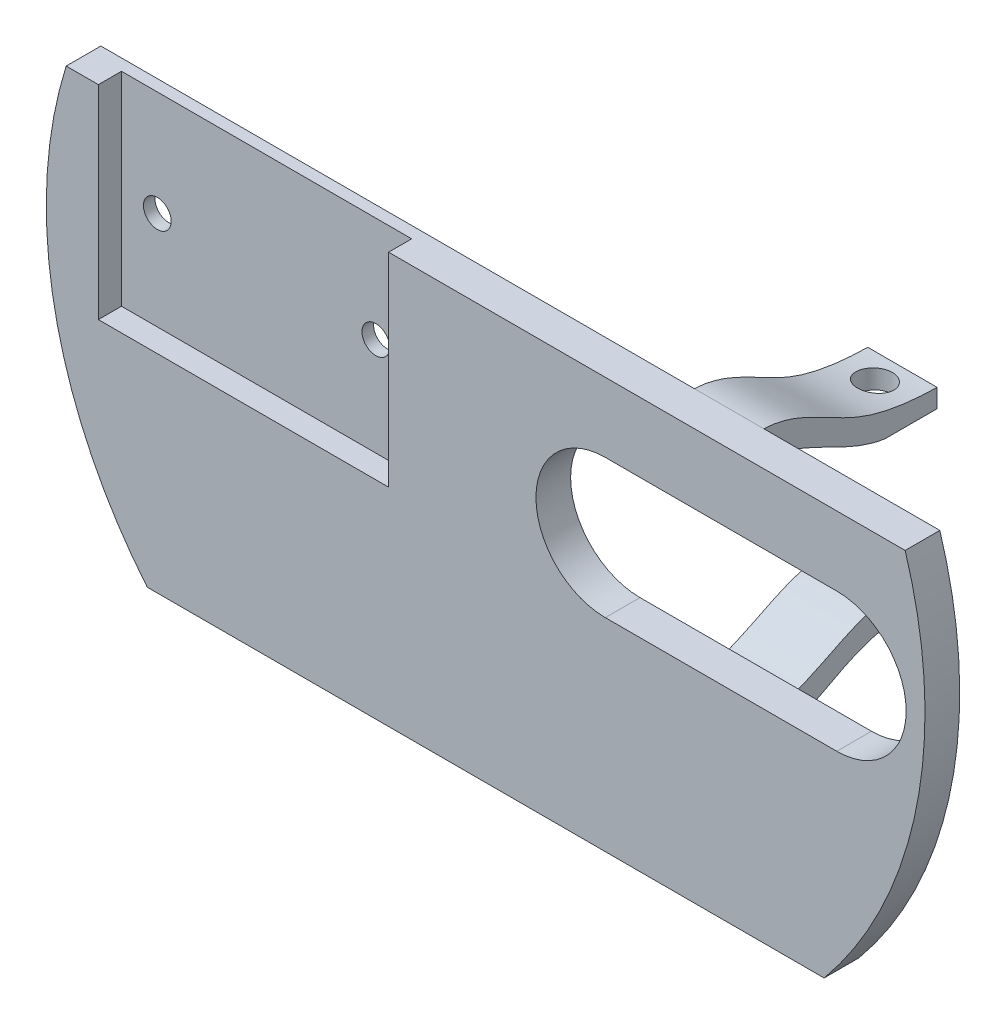
from build123d import *

# Parameters (mm, degrees)
SKETCH5_W               = 82.5
SKETCH5_H               = 35.530981805
BOSS_EXTRUDE1_DEPTH     = 3
SKETCH8_R               = 53.75957742
SKETCH8_R_2             = 38
CUT_EXTRUDE1_DEPTH      = 13
SKETCH7_W               = 25.1
SKETCH7_H               = 23.6
CUT_EXTRUDE2_DEPTH      = 2
SKETCH10_W              = 6
SKETCH10_H              = 6
BOSS_EXTRUDE2_DEPTH     = 15
CUT_EXTRUDE3_DEPTH      = 12
CUT_EXTRUDE4_DEPTH      = 12
CUT_EXTRUDE5_DEPTH      = 17
CUT_EXTRUDE5_DEPTH_BACK = 12
SKETCH15_R              = 1.5
SKETCH16_R              = 1.2
CUT_EXTRUDE6_DEPTH      = 10


with BuildPart() as part:
    # Sketch5 → Boss-Extrude1 (new body)
    with BuildSketch(Plane.XY):
        with Locations((41.25, 4.834509098)):
            Rectangle(SKETCH5_W, SKETCH5_H)
    extrude(amount=BOSS_EXTRUDE1_DEPTH)

    # Sketch8 → Cut-Extrude1 (cut)
    with BuildSketch(Plane.XY.offset(3)):
        with Locations((41.25, 11.3)):
            Circle(SKETCH8_R)
        with Locations((41.25, 11.3)):
            Circle(SKETCH8_R_2, mode=Mode.SUBTRACT)
    extrude(amount=-CUT_EXTRUDE1_DEPTH, mode=Mode.SUBTRACT)

    # Sketch7 → Cut-Extrude2 (cut)
    with BuildSketch(Plane.XY.offset(3)):
        with Locations((20.303816898, 16.8)):
            Rectangle(SKETCH7_W, SKETCH7_H)
    extrude(amount=-CUT_EXTRUDE2_DEPTH, mode=Mode.SUBTRACT)

    # Sketch10 → Boss-Extrude2 (add)
    with BuildSketch(Plane(origin=(0, 0, 0), x_dir=(-1, 0, 0), z_dir=(0, 0, -1))):
        with Locations((-59.301708923, 1.6)):
            Rectangle(SKETCH10_W, SKETCH10_H)
        with Locations((-59.301708923, 19.6)):
            Rectangle(SKETCH10_W, SKETCH10_H)
    extrude(amount=BOSS_EXTRUDE2_DEPTH)

    # Sketch11 → Cut-Extrude3 (cut)
    with BuildSketch(Plane.ZY.offset(-56.301708923)):
        with BuildLine():
            Line((-15.673682817, 18.188265047), (-15.673682817, 24.450923395))
            Line((-15.673682817, 24.450923395), (0, 24.450923395))
            Line((0, 24.450923395), (0, 22.6))
            add(Edge.make_bspline(
                [(0, 22.6), (-3.159886635, 22.462578072), (-7.547752793, 18.690290822), (-13.247203151, 18.200972407), (-15.673682817, 18.188265047)],
                knots=[0, 0, 0, 0, 0.549888978, 1, 1, 1, 1], degree=3))
        make_face()
        with BuildLine():
            Line((-10.484624341, 16.6), (-10.708289412, 12.015073246))
            Line((-10.708289412, 12.015073246), (0, 12.015073246))
            Line((0, 12.015073246), (0, 20.424934677))
            add(Edge.make_bspline(
                [(0, 20.424934677), (-1.83740901, 20.191851474), (-5.266921055, 18.665051954), (-8.555682053, 16.881899659), (-10.484624341, 16.6)],
                knots=[0, 0, 0, 0, 0.489527902, 1, 1, 1, 1], degree=3))
        make_face()
        with BuildLine():
            Line((0, 9.184926754), (0, 0.775065323))
            add(Edge.make_bspline(
                [(0, 0.775065323), (-1.83740901, 1.008148526), (-5.266921055, 2.534948046), (-8.555682053, 4.318100341), (-10.484624341, 4.6)],
                knots=[0, 0, 0, 0, 0.489527902, 1, 1, 1, 1], degree=3))
            Line((-10.484624341, 4.6), (-10.708289412, 9.184926754))
            Line((-10.708289412, 9.184926754), (0, 9.184926754))
        make_face()
        with BuildLine():
            Line((0, -3.250923395), (0, -1.4))
            add(Edge.make_bspline(
                [(0, -1.4), (-3.159886635, -1.262578072), (-7.547752793, 2.509709178), (-13.247203151, 2.999027593), (-15.673682817, 3.011734953)],
                knots=[0, 0, 0, 0, 0.549888978, 1, 1, 1, 1], degree=3))
            Line((-15.673682817, 3.011734953), (-15.673682817, -3.250923395))
            Line((-15.673682817, -3.250923395), (0, -3.250923395))
        make_face()
    extrude(amount=-CUT_EXTRUDE3_DEPTH, mode=Mode.SUBTRACT)

    # Sketch14 → Cut-Extrude4 (cut)
    with BuildSketch(Plane(origin=(0, 0, 0), x_dir=(-1, 0, 0), z_dir=(0, 0, -1))):
        with BuildLine():
            Line((-71.618289014, 16.6), (-51.598213122, 16.6))
            ThreePointArc((-51.598213122, 16.6), (-45.598213122, 10.6), (-51.598213122, 4.6))
            Line((-51.598213122, 4.6), (-71.618289014, 4.6))
            ThreePointArc((-71.618289014, 4.6), (-77.618289014, 10.6), (-71.618289014, 16.6))
        make_face()
    extrude(amount=-CUT_EXTRUDE4_DEPTH, mode=Mode.SUBTRACT)

    # Sketch15 → Cut-Extrude5 (cut, two sides: drawn at the far end of the back side and taken through both)
    with BuildSketch(Plane(origin=(0, 16.6, 0), x_dir=(-1, 0, 0), z_dir=(0, -1, 0)).offset(-CUT_EXTRUDE5_DEPTH_BACK)):
        with Locations(Location((-59.266135992, 12.650675834, 0), (0, 0, 90))):
            Circle(SKETCH15_R)
    extrude(amount=CUT_EXTRUDE5_DEPTH + CUT_EXTRUDE5_DEPTH_BACK, mode=Mode.SUBTRACT)

    # Sketch16 → Cut-Extrude6 (cut)
    with BuildSketch(Plane.XY.offset(1)):
        with BuildLine():
            ThreePointArc((12.053816898, 13.5), (10.853816898, 14.7), (9.653816898, 13.5))
            Line((9.653816898, 13.5), (10.853816898, 13.5))
            Line((10.853816898, 13.5), (10.853816898, 12.3))
            ThreePointArc((10.853816898, 12.3), (11.702345036, 12.651471863), (12.053816898, 13.5))
        make_face()
        with BuildLine():
            Line((10.853816898, 13.5), (9.653816898, 13.5))
            ThreePointArc((9.653816898, 13.5), (10.005288761, 12.651471863), (10.853816898, 12.3))
            Line((10.853816898, 12.3), (10.853816898, 13.5))
        make_face()
        with Locations((29.753816898, 13.5)):
            Circle(SKETCH16_R)
    extrude(amount=-CUT_EXTRUDE6_DEPTH, mode=Mode.SUBTRACT)


solid = part.part
